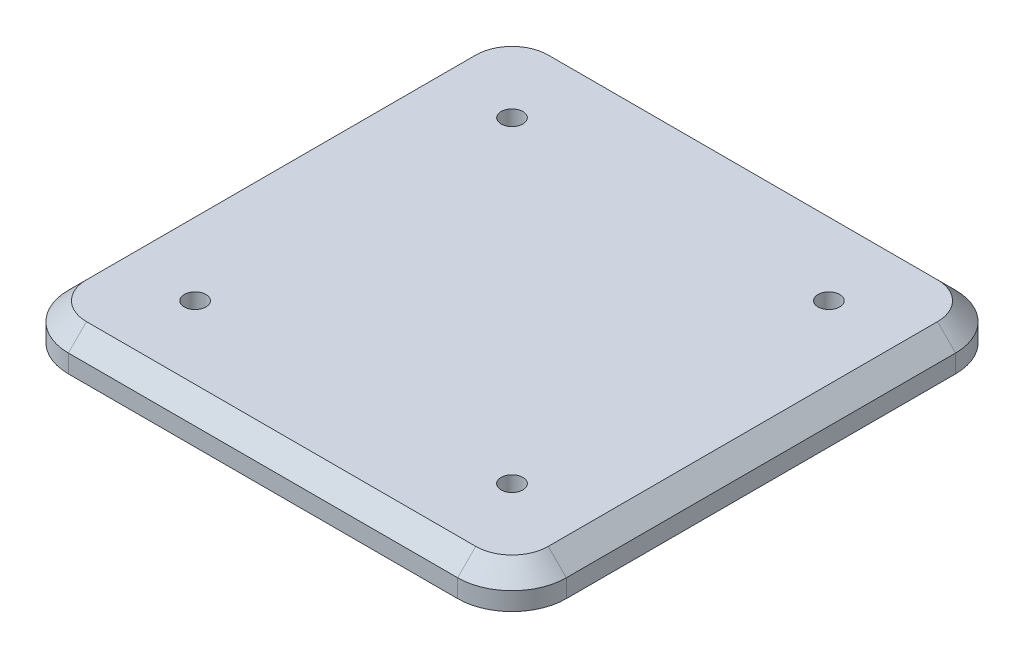
from build123d import *

# Parameters (mm, degrees)
SKETCH_1_W                 = 275
SKETCH_1_H                 = 275
EXTRUDE_1_DEPTH            = 20
FILLET_1_R                 = 30
CHAMFER_1_SIZE             = 10
F_20_0MM_1_D               = 12
F_20_0MM_1_DEPTH           = 10
F_20_0MM_1_TIP             = 3.605163714
F_20_0MM_1_ON_FACE_2_D     = 12
F_20_0MM_1_ON_FACE_2_DEPTH = 10
F_20_0MM_1_ON_FACE_2_TIP   = 3.605163714


with BuildPart() as part:
    # 草圖1 → 填料-伸長1 (new body)
    with BuildSketch(Plane(origin=(0, 0, 0), x_dir=(1, 0, 0), z_dir=(0, 1, 0))):
        with Locations((137.5, 137.5)):
            Rectangle(SKETCH_1_W, SKETCH_1_H)
    extrude(amount=EXTRUDE_1_DEPTH)

    # 圓角1
    fillet_1_edges = [part.edges().sort_by_distance(p)[0] for p in [
        (0, 10, -275),
        (275, 10, -275),
        (275, 10, 0),
        (0, 10, 0),
    ]]
    fillet(fillet_1_edges, radius=FILLET_1_R)

    # 導角1
    chamfer_1_edges = [part.edges().sort_by_distance(p)[0] for p in [
        (0, 20, -137.5),
        (137.5, 20, -275),
        (137.5, 20, 0),
        (275, 20, -137.5),
        (8.786796564, 20, -8.786796564),
        (266.213203436, 20, -8.786796564),
        (266.213203436, 20, -266.213203436),
        (8.786796564, 20, -266.213203436),
    ]]
    chamfer(chamfer_1_edges, length=CHAMFER_1_SIZE)

    # Ø20.0mm 定位孔1
    with Locations(Plane(origin=(50, 20, -50), x_dir=(0, 0, 1), z_dir=(0, 1, 0))):
        with Locations((0, 0), (-175, 0), (-175, 175), (0, 175)):
            Hole(F_20_0MM_1_D / 2, depth=F_20_0MM_1_DEPTH)
            with Locations((0, 0, -(F_20_0MM_1_DEPTH + F_20_0MM_1_TIP / 2))):  # 118° drill point
                Cone(0, F_20_0MM_1_D / 2, F_20_0MM_1_TIP, mode=Mode.SUBTRACT)

    # Ø20.0mm 定位孔1 on face 2
    with Locations(Plane(origin=(25, 0, -25), x_dir=(0, 0, -1), z_dir=(0, -1, 0))):
        with Locations((0, 0), (0, 225), (225, 225), (225, 0)):
            Hole(F_20_0MM_1_ON_FACE_2_D / 2, depth=F_20_0MM_1_ON_FACE_2_DEPTH)
            with Locations((0, 0, -(F_20_0MM_1_ON_FACE_2_DEPTH + F_20_0MM_1_ON_FACE_2_TIP / 2))):  # 118° drill point
                Cone(0, F_20_0MM_1_ON_FACE_2_D / 2, F_20_0MM_1_ON_FACE_2_TIP, mode=Mode.SUBTRACT)


solid = part.part
